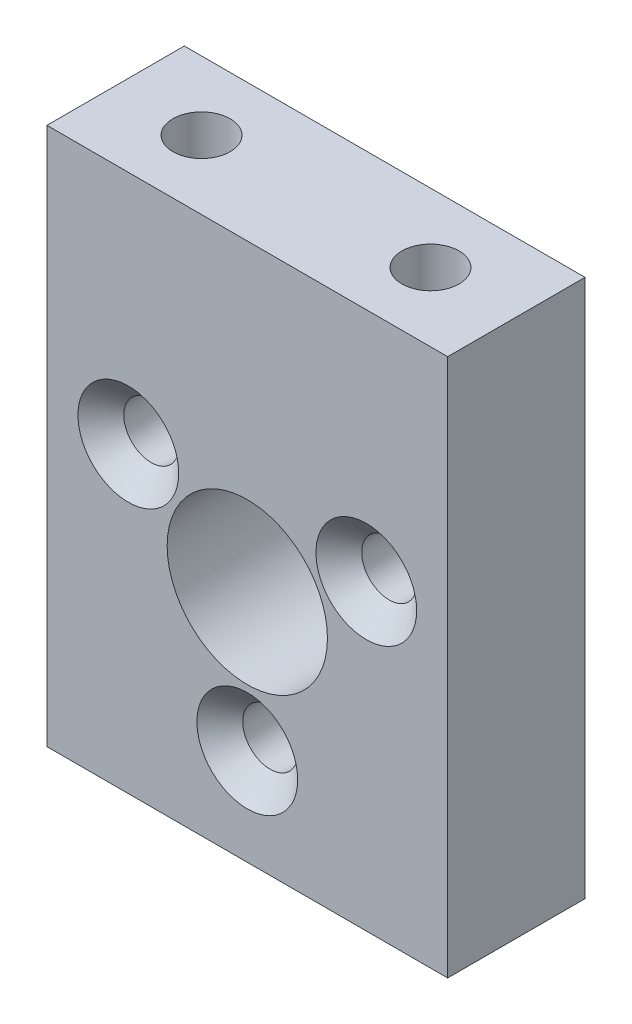
from build123d import *

# Parameters (mm, degrees)
SKETCH1_W                                           = 17.5
SKETCH1_H                                           = 23.5
SKETCH1_R                                           = 3.5
BOSS_EXTRUDE1_DEPTH                                 = 3
CSK_FOR_M2_COUNTERSUNK_FLAT_HEAD_SCREW1_D           = 2.4
CSK_FOR_M2_COUNTERSUNK_FLAT_HEAD_SCREW1_CSINK_D     = 4.4
CSK_FOR_M2_COUNTERSUNK_FLAT_HEAD_SCREW1_CSINK_ANGLE = 90
TAP_DRILL_FOR_M3_TAP1_D                             = 2.5
TAP_DRILL_FOR_M3_TAP1_DEPTH                         = 6
TAP_DRILL_FOR_M3_TAP1_TIP                           = 0.751075774


with BuildPart() as part:
    # Sketch1 → Boss-Extrude1 (new, symmetric)
    with BuildSketch(Plane.XY):
        Rectangle(SKETCH1_W, SKETCH1_H)
        with Locations((0, -1.53)):
            Circle(SKETCH1_R, mode=Mode.SUBTRACT)
    extrude(amount=BOSS_EXTRUDE1_DEPTH, both=True)

    # CSK for M2 Countersunk Flat Head Screw1 (through all)
    with Locations(Plane.XY.offset(3)):
        with Locations((0, -7.53), (-5.196152423, 1.47), (5.196152423, 1.47)):
            CounterSinkHole(CSK_FOR_M2_COUNTERSUNK_FLAT_HEAD_SCREW1_D / 2, CSK_FOR_M2_COUNTERSUNK_FLAT_HEAD_SCREW1_CSINK_D / 2, counter_sink_angle=CSK_FOR_M2_COUNTERSUNK_FLAT_HEAD_SCREW1_CSINK_ANGLE)

    # Tap Drill for M3 Tap1
    with Locations(Plane(origin=(0, 11.75, 0), x_dir=(1, 0, 0), z_dir=(0, 1, 0))):
        with Locations((-5, 0), (5, 0)):
            Hole(TAP_DRILL_FOR_M3_TAP1_D / 2, depth=TAP_DRILL_FOR_M3_TAP1_DEPTH)
            with Locations((0, 0, -(TAP_DRILL_FOR_M3_TAP1_DEPTH + TAP_DRILL_FOR_M3_TAP1_TIP / 2))):  # 118° drill point
                Cone(0, TAP_DRILL_FOR_M3_TAP1_D / 2, TAP_DRILL_FOR_M3_TAP1_TIP, mode=Mode.SUBTRACT)


solid = part.part
